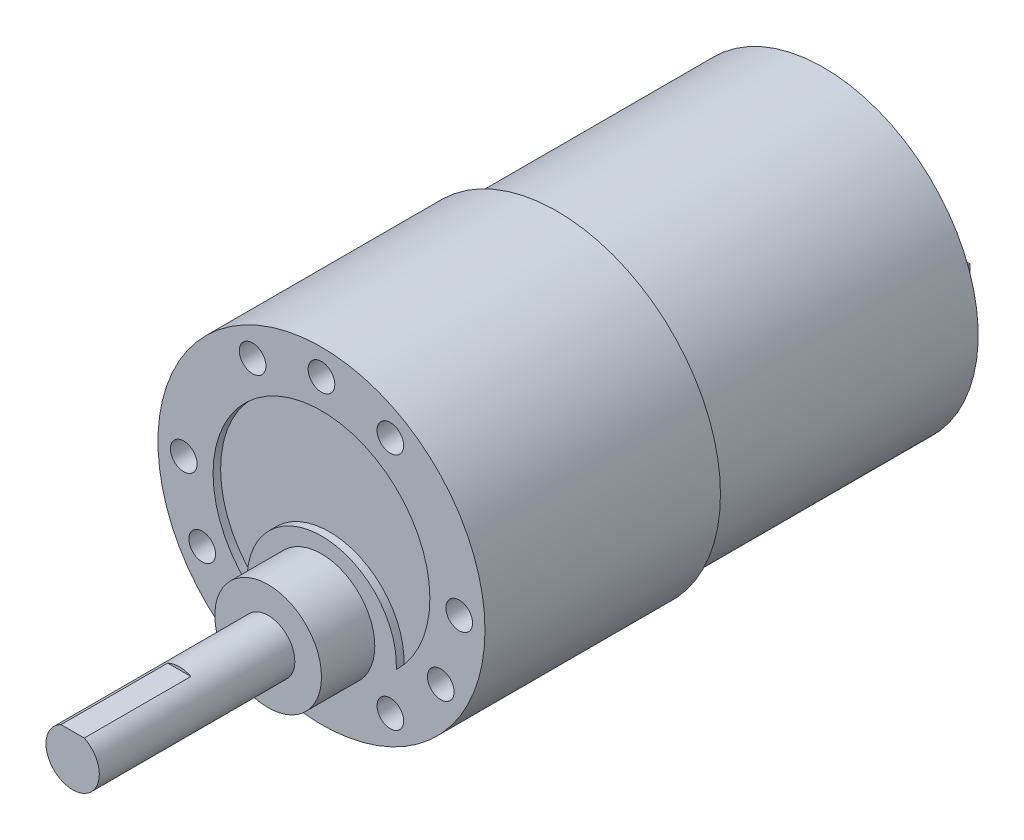
from build123d import *

# Parameters (mm, degrees)
CROQUIS1_R              = 18.4
SALIENTE_EXTRUIR1_DEPTH = 26.5
CORTAR_EXTRUIR2_DEPTH   = 0.85
CROQUIS3_R              = 1.5
CORTAR_EXTRUIR3_DEPTH   = 25
CROQUIS9_R              = 1.5
CORTAR_EXTRUIR4_DEPTH   = 5
CROQUIS22_R             = 6
SALIENTE_EXTRUIR2_DEPTH = 6
CROQUIS24_R             = 3
SALIENTE_EXTRUIR3_DEPTH = 22
CORTAR_EXTRUIR5_DEPTH   = 12
CROQUIS26_R             = 17.4
SALIENTE_EXTRUIR4_DEPTH = 30
CROQUIS27_R             = 3.9
CROQUIS27_R_2           = 2.25
CROQUIS27_W             = 0.5
CROQUIS27_H             = 3
SALIENTE_EXTRUIR5_DEPTH = 1.6
CROQUIS29_W             = 0.5
CROQUIS29_H             = 3
SALIENTE_EXTRUIR6_DEPTH = 5


with BuildPart() as part:
    # Croquis1 → Saliente-Extruir1 (new body)
    with BuildSketch(Plane.XY):
        Circle(CROQUIS1_R)
    extrude(amount=SALIENTE_EXTRUIR1_DEPTH)

    # Croquis2 → Cortar-Extruir2 (cut)
    with BuildSketch(Plane.XY.offset(26.5)):
        with BuildLine():
            ThreePointArc((8.4190219, -8.8295), (-0.043589152, 12.19992213), (-8.355713846, -8.889434523))
            ThreePointArc((-8.355713846, -8.889434523), (0, 0), (8.4190219, -8.8295))
        make_face()
    extrude(amount=-CORTAR_EXTRUIR2_DEPTH, mode=Mode.SUBTRACT)

    # Croquis3 → Cortar-Extruir3 (cut)
    with BuildSketch(Plane.XY.offset(26.5)):
        with Locations((0, 15.5)):
            Circle(CROQUIS3_R)
        with Locations((13.423393759, -7.75)):
            Circle(CROQUIS3_R)
        with Locations((-13.423393759, -7.75)):
            Circle(CROQUIS3_R)
    extrude(amount=-CORTAR_EXTRUIR3_DEPTH, mode=Mode.SUBTRACT)

    # Croquis9 → Cortar-Extruir4 (cut)
    with BuildSketch(Plane.XY.offset(26.5)):
        with Locations((-15.5, 0)):
            Circle(CROQUIS9_R)
        with Locations((-7.75, 13.423393759)):
            Circle(CROQUIS9_R)
        with Locations((7.75, 13.423393759)):
            Circle(CROQUIS9_R)
        with Locations((15.5, 0)):
            Circle(CROQUIS9_R)
        with Locations((7.75, -13.423393759)):
            Circle(CROQUIS9_R)
        with Locations((-7.75, -13.423393759)):
            Circle(CROQUIS9_R)
    extrude(amount=-CORTAR_EXTRUIR4_DEPTH, mode=Mode.SUBTRACT)

    # Croquis22 → Saliente-Extruir2 (add)
    with BuildSketch(Plane.XY.offset(26.5)):
        with Locations((0, -7.75)):
            Circle(CROQUIS22_R)
    extrude(amount=SALIENTE_EXTRUIR2_DEPTH)

    # Croquis24 → Saliente-Extruir3 (add)
    with BuildSketch(Plane.XY.offset(32.5)):
        with Locations((0, -7.75)):
            Circle(CROQUIS24_R)
    extrude(amount=SALIENTE_EXTRUIR3_DEPTH)

    # Croquis25 → Cortar-Extruir5 (cut)
    with BuildSketch(Plane.XY.offset(54.5)):
        Polygon((-72.570863995, -5.05), (-1.307669683, -5.05), (1.307669683, -5.05), (72.570863995, -5.05), (72.570863995, 137.476388625), (-72.570863995, 137.476388625), align=None)
    extrude(amount=-CORTAR_EXTRUIR5_DEPTH, mode=Mode.SUBTRACT)

    # Croquis26 → Saliente-Extruir4 (add)
    with BuildSketch(Plane(origin=(0, 0, 0), x_dir=(-1, 0, 0), z_dir=(0, 0, -1))):
        Circle(CROQUIS26_R)
    extrude(amount=SALIENTE_EXTRUIR4_DEPTH)

    # Croquis27 → Saliente-Extruir5 (add)
    # profile 1 of 3: a face of its own
    with BuildSketch(Plane(origin=(0, 0, -30), x_dir=(-1, 0, 0), z_dir=(0, 0, -1))):
        Circle(CROQUIS27_R)
    # profile 2 of 3: a face of its own
    with BuildSketch(Plane(origin=(0, 0, -30), x_dir=(-1, 0, 0), z_dir=(0, 0, -1))):
        with Locations((-11.25, 0)):
            Circle(CROQUIS27_R_2)
        with Locations((-11.25, 0)):
            Rectangle(CROQUIS27_W, CROQUIS27_H, mode=Mode.SUBTRACT)
    # profile 3 of 3: a face of its own
    with BuildSketch(Plane(origin=(0, 0, -30), x_dir=(-1, 0, 0), z_dir=(0, 0, -1))):
        with Locations(Location((11.25, 0, 0), (0, 0, 180))):
            Circle(CROQUIS27_R_2)
        with Locations((11.25, 0)):
            Rectangle(CROQUIS27_W, CROQUIS27_H, mode=Mode.SUBTRACT)
    extrude(amount=SALIENTE_EXTRUIR5_DEPTH)

    # Croquis29 → Saliente-Extruir6 (add)
    with BuildSketch(Plane(origin=(0, 0, -30), x_dir=(-1, 0, 0), z_dir=(0, 0, -1))):
        with Locations((-11.25, 0)):
            Rectangle(CROQUIS29_W, CROQUIS29_H)
        with Locations((11.25, 0)):
            Rectangle(CROQUIS29_W, CROQUIS29_H)
    extrude(amount=SALIENTE_EXTRUIR6_DEPTH)


solid = part.part
